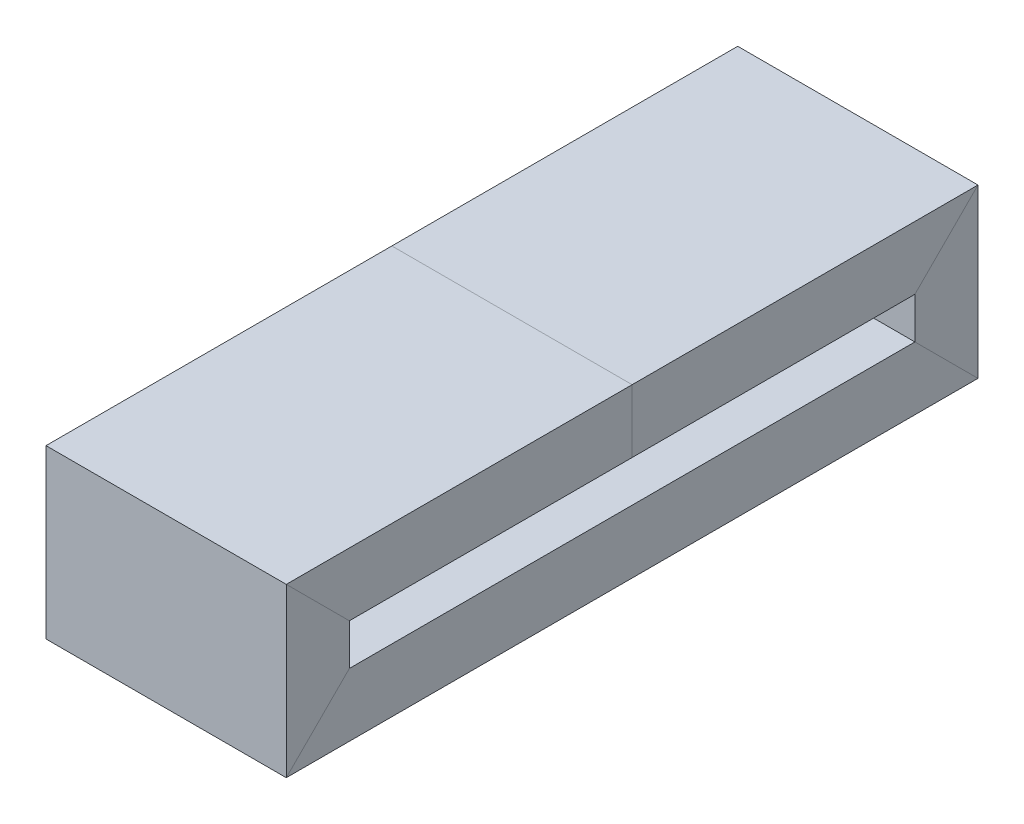
from build123d import *

# Parameters (mm, degrees)
CROSS_SECTION_W = 9.9
CROSS_SECTION_H = 2.6


with BuildPart() as part:
    # Sweep1: sweep along a path in path
    with BuildLine(Plane(origin=(0, 0, 0), x_dir=(0, 0, -1), z_dir=(1, 0, 0))) as sweep1_path:
        Line((-12.95, 2.15), (12.95, 2.15))
        Line((12.95, 2.15), (12.95, -2.15))
        Line((12.95, -2.15), (-12.95, -2.15))
        Line((-12.95, -2.15), (-12.95, 2.15))
    # cross-section → Sweep1 (sweep)
    with BuildSketch(Plane.XY):
        with Locations((0, 2.15)):
            Rectangle(CROSS_SECTION_W, CROSS_SECTION_H)
    sweep(path=sweep1_path.line, transition=Transition.RIGHT)


solid = part.part
